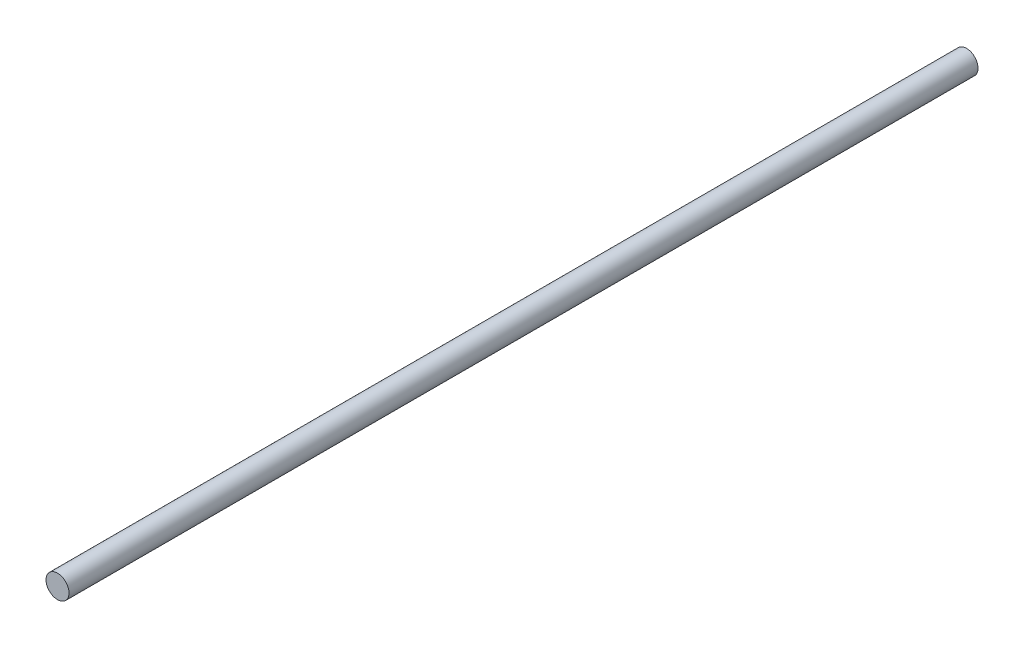
from build123d import *

# Parameters (mm, degrees)
SKETCH_1_R      = 10
EXTRUDE_1_DEPTH = 790


with BuildPart() as part:
    # 草图1 → 凸台-拉伸1 (new body)
    with BuildSketch(Plane.XY):
        with Locations(Location((0, 0, 0), (0, 0, 180))):
            Circle(SKETCH_1_R)
    extrude(amount=EXTRUDE_1_DEPTH)


solid = part.part
